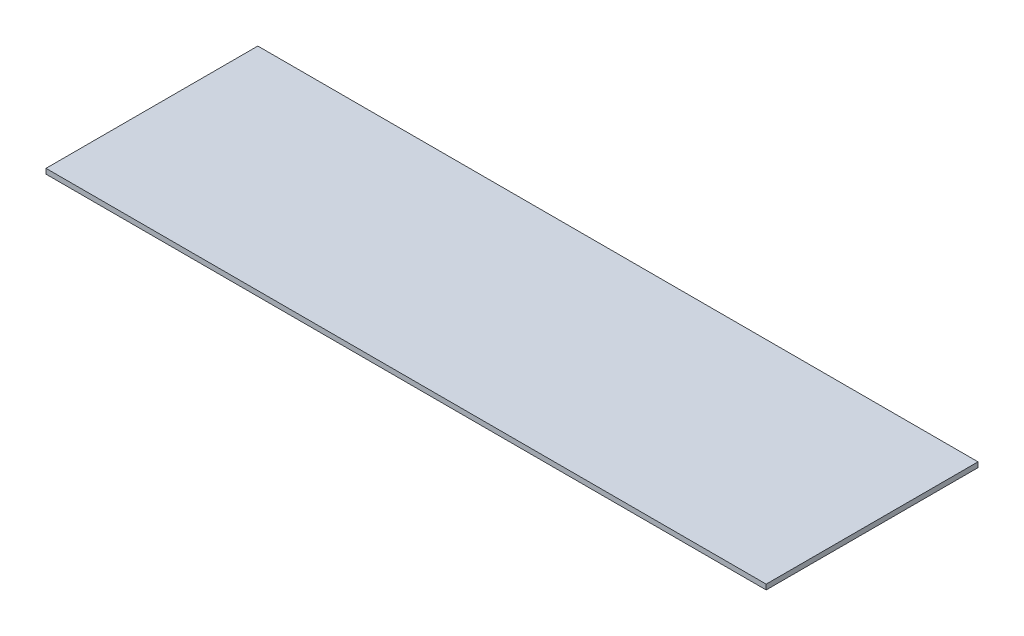
from build123d import *

# Parameters (mm, degrees)
SKETCH1_W           = 1700
SKETCH1_H           = 500
BOSS_EXTRUDE1_DEPTH = 12


with BuildPart() as part:
    # Sketch1 → Boss-Extrude1 (new body)
    with BuildSketch(Plane(origin=(0, 0, 0), x_dir=(1, 0, 0), z_dir=(0, 1, 0))):
        Rectangle(SKETCH1_W, SKETCH1_H)
    extrude(amount=BOSS_EXTRUDE1_DEPTH)


solid = part.part
